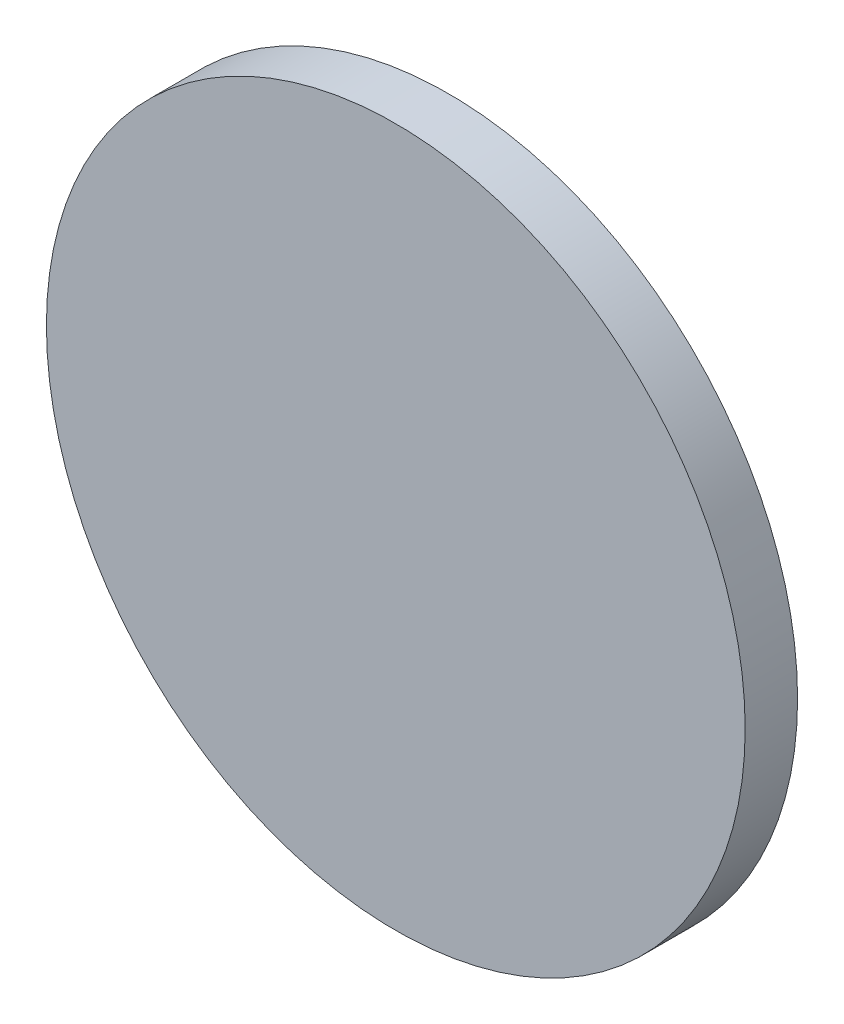
from build123d import *

# Parameters (mm, degrees)
SKETCH_1_R      = 40
EXTRUDE_1_DEPTH = 6


with BuildPart() as part:
    # 草图1 → 凸台-拉伸1 (new body)
    with BuildSketch(Plane.XY):
        Circle(SKETCH_1_R)
    extrude(amount=EXTRUDE_1_DEPTH)


solid = part.part
